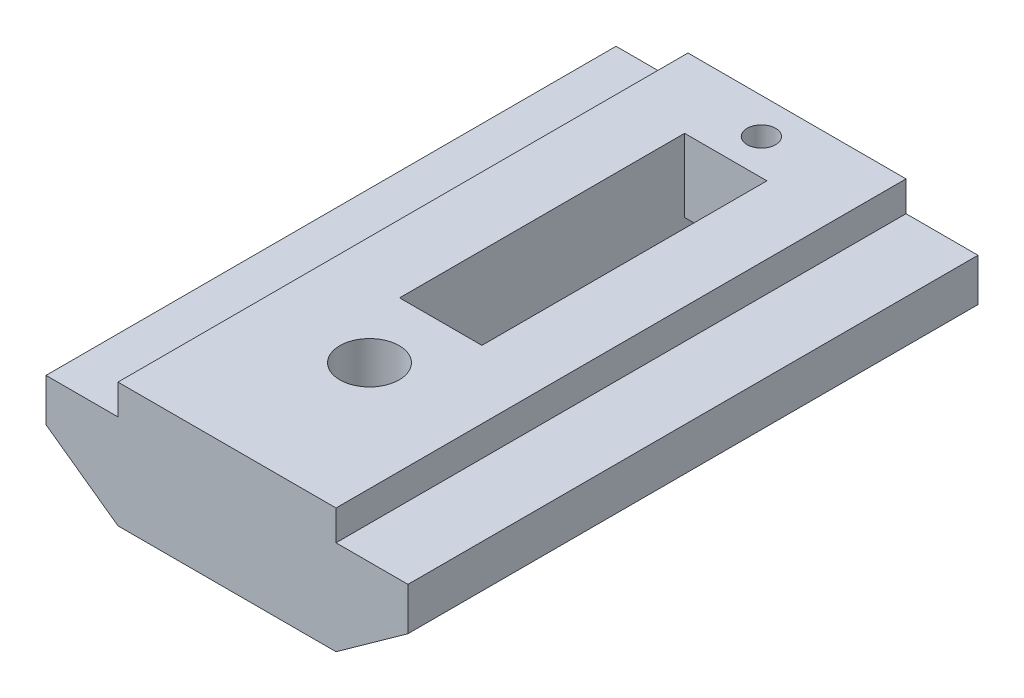
from build123d import *

# Parameters (mm, degrees)
BOSS_EXTRUDE1_DEPTH = 40
SKETCH2_R           = 2.0828
SKETCH2_R_2         = 1
CUT_EXTRUDE1_DEPTH  = 43.867462538
SKETCH3_W           = 5.776667402
SKETCH3_H           = 20
CUT_EXTRUDE2_DEPTH  = 43.867462538
SKETCH4_W           = 5.776667402
SKETCH4_H           = 5
CUT_EXTRUDE3_DEPTH  = 3.62
SKETCH5_R           = 4.0005
CUT_EXTRUDE4_DEPTH  = 2.2098


with BuildPart() as part:
    # Sketch1 → Boss-Extrude1 (new body)
    with BuildSketch(Plane.XY):
        Polygon((-7.65, 5.116666667), (7.65, 5.116666667), (7.65, 3), (12.7, 3), (12.7, 0), (7.65, -3.62), (-7.65, -3.62), (-12.7, 0), (-12.7, 3), (-7.65, 3), align=None)
    extrude(amount=BOSS_EXTRUDE1_DEPTH)

    # Sketch2 → Cut-Extrude1 (cut, through all)
    with BuildSketch(Plane.XZ.offset(3.62)):
        with Locations(Location((0, 30, 0), (0, 0, 270))):
            Circle(SKETCH2_R)
        with Locations(Location((0, 2.5, 0), (0, 0, 270))):
            Circle(SKETCH2_R_2)
    extrude(amount=-CUT_EXTRUDE1_DEPTH, mode=Mode.SUBTRACT)

    # Sketch3 → Cut-Extrude2 (cut, through all)
    with BuildSketch(Plane.XZ.offset(3.62)):
        with Locations((0, 15)):
            Rectangle(SKETCH3_W, SKETCH3_H)
    extrude(amount=-CUT_EXTRUDE2_DEPTH, mode=Mode.SUBTRACT)

    # Sketch4 → Cut-Extrude3 (cut)
    with BuildSketch(Plane.XZ.offset(3.62)):
        with Locations((0, 2.5)):
            Rectangle(SKETCH4_W, SKETCH4_H)
    extrude(amount=-CUT_EXTRUDE3_DEPTH, mode=Mode.SUBTRACT)

    # Sketch5 → Cut-Extrude4 (cut)
    with BuildSketch(Plane.XZ.offset(3.62)):
        with Locations(Location((0, 30, 0), (0, 0, 270))):
            Circle(SKETCH5_R)
    extrude(amount=-CUT_EXTRUDE4_DEPTH, mode=Mode.SUBTRACT)


solid = part.part
